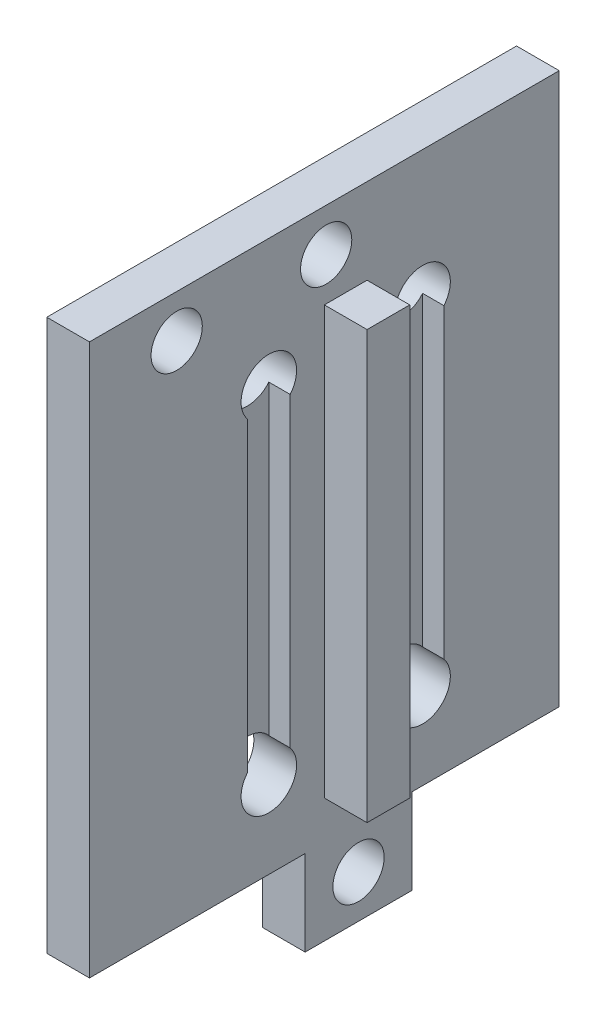
from build123d import *

# Parameters (mm, degrees)
SKETCH_1_R          = 0.6
SKETCH_1_W          = 4.5
SKETCH_1_H          = 10
SKETCH_1_R_2        = 0.65
SKETCH_1_W_2        = 1
SKETCH_1_W_3        = 2.5
SKETCH_1_H_2        = 2
EXTRUDE_1_DEPTH     = 1
EXTRUDE_START       = 1
SKETCH_1_4_W        = 1
SKETCH_1_4_H        = 10
EXTRUDE_2_DEPTH     = 1
SKETCH_2_W          = 1
SKETCH_2_H          = 8
CUT_EXTRUDE_1_DEPTH = 0.5


with BuildPart() as part:
    # 草图1 → 凸台-拉伸1 (new body)
    # profile 1 of 7: a face of its own
    with BuildSketch(Plane(origin=(0, 0, 0), x_dir=(0, 0, -1), z_dir=(1, 0, 0))):
        Polygon((0, 2), (0, 0), (4.5, 0), (5.5, 0), (10, 0), (10, 2), align=None)
        with Locations((1.042294057, 1)):
            Circle(SKETCH_1_R, mode=Mode.SUBTRACT)
        with Locations((4.542294057, 1)):
            Circle(SKETCH_1_R, mode=Mode.SUBTRACT)
    # profile 2 of 7: a face of its own
    with BuildSketch(Plane(origin=(0, 0, 0), x_dir=(0, 0, -1), z_dir=(1, 0, 0))):
        with Locations((2.25, -5)):
            Rectangle(SKETCH_1_W, SKETCH_1_H)
        with Locations((3.2, -9)):
            Circle(SKETCH_1_R_2, mode=Mode.SUBTRACT)
        with Locations((3.2, -1)):
            Circle(SKETCH_1_R_2, mode=Mode.SUBTRACT)
    # profile 3 of 7: a face of its own
    with BuildSketch(Plane(origin=(0, 0, 0), x_dir=(0, 0, -1), z_dir=(1, 0, 0))):
        Polygon((0, -10), (0, 0), (0, 2), (-1, 2), (-1, -10.9), (0, -10.9), align=None)
    # profile 4 of 7: a face of its own
    with BuildSketch(Plane(origin=(0, 0, 0), x_dir=(0, 0, -1), z_dir=(1, 0, 0))):
        with Locations((5, -5)):
            Rectangle(SKETCH_1_W_2, SKETCH_1_H)
    # profile 5 of 7: a face of its own
    with BuildSketch(Plane(origin=(0, 0, 0), x_dir=(0, 0, -1), z_dir=(1, 0, 0))):
        Polygon((4.5, -10), (0, -10), (0, -10.9), (4.05, -10.9), (6.55, -10.9), (10, -10.9), (10, -10), (5.5, -10), align=None)
    # profile 6 of 7: a face of its own
    with BuildSketch(Plane(origin=(0, 0, 0), x_dir=(0, 0, -1), z_dir=(1, 0, 0))):
        with Locations((7.75, -5)):
            Rectangle(SKETCH_1_W, SKETCH_1_H)
        with Locations((6.8, -9)):
            Circle(SKETCH_1_R_2, mode=Mode.SUBTRACT)
        with Locations((6.8, -1)):
            Circle(SKETCH_1_R_2, mode=Mode.SUBTRACT)
    # profile 7 of 7: a face of its own
    with BuildSketch(Plane(origin=(0, 0, 0), x_dir=(0, 0, -1), z_dir=(1, 0, 0))):
        with Locations((5.3, -11.9)):
            Rectangle(SKETCH_1_W_3, SKETCH_1_H_2)
        with Locations((5.3, -11.9)):
            Circle(SKETCH_1_R, mode=Mode.SUBTRACT)
    extrude(amount=EXTRUDE_1_DEPTH)

    # 草图1<4> → 凸台-拉伸2 (add)
    with BuildSketch(Plane(origin=(0, 0, 0), x_dir=(0, 0, -1), z_dir=(1, 0, 0)).offset(EXTRUDE_START)):
        with Locations((5, -5)):
            Rectangle(SKETCH_1_4_W, SKETCH_1_4_H)
    extrude(amount=EXTRUDE_2_DEPTH)

    # 草图2 → 切除-拉伸1 (cut)
    with BuildSketch(Plane(origin=(1, 0, 0), x_dir=(0, 0, -1), z_dir=(1, 0, 0))):
        with Locations((6.8, -5.415331193)):
            Rectangle(SKETCH_2_W, SKETCH_2_H)
        with Locations((3.2, -5.415331193)):
            Rectangle(SKETCH_2_W, SKETCH_2_H)
    extrude(amount=-CUT_EXTRUDE_1_DEPTH, mode=Mode.SUBTRACT)


solid = part.part
